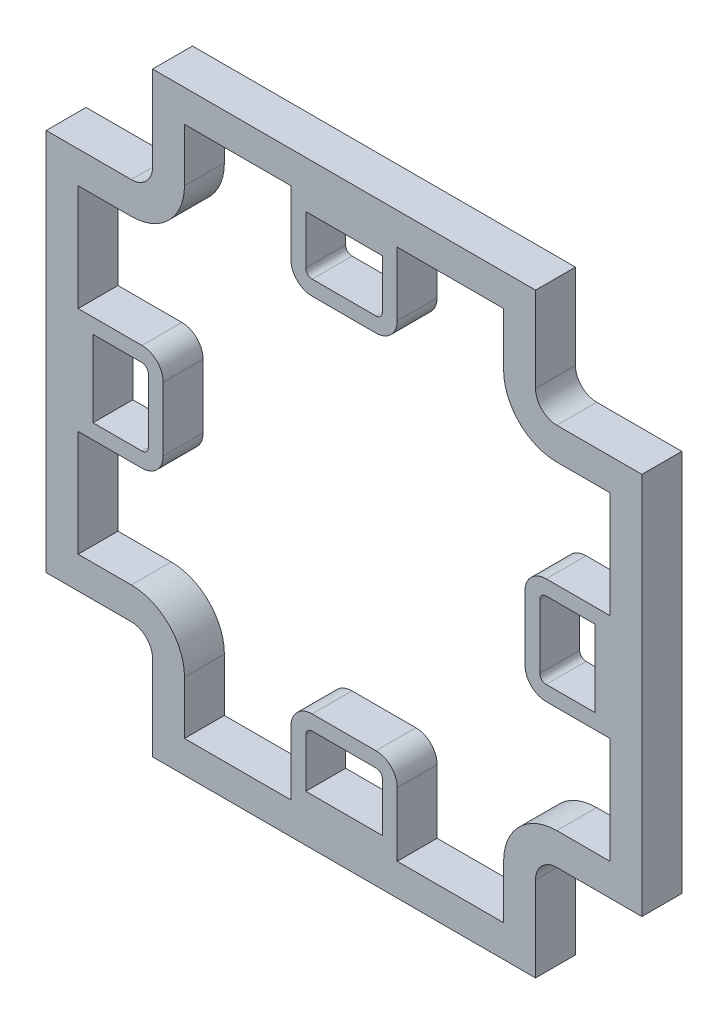
from build123d import *

# Parameters (mm, degrees)
EXTRUDE_THIN1_DEPTH = 3.75
EXTRUDE_THIN2_DEPTH = 3.75
EXTRUDE_THIN3_DEPTH = 3.75


with BuildPart() as part:
    # Sketch1 → Extrude-Thin1 (new body)
    with BuildSketch(Plane.XY):
        with BuildLine():
            Line((73, 62), (73, 54))
            Line((73, 54), (109, 54))
            Line((109, 54), (109, 62))
            ThreePointArc((109, 62), (109.585786438, 63.414213562), (111, 64))
            Line((111, 64), (119, 64))
            Line((119, 64), (119, 100))
            Line((119, 100), (111, 100))
            ThreePointArc((111, 100), (109.585786438, 100.585786438), (109, 102))
            Line((109, 102), (109, 110))
            Line((109, 110), (73, 110))
            Line((73, 110), (73, 102))
            ThreePointArc((73, 102), (72.414213562, 100.585786438), (71, 100))
            Line((71, 100), (63, 100))
            Line((63, 100), (63, 64))
            Line((63, 64), (71, 64))
            ThreePointArc((71, 64), (72.414213562, 63.414213562), (73, 62))
        make_face()
        with BuildLine():
            Line((76, 62), (76, 57))
            Line((76, 57), (106, 57))
            Line((106, 57), (106, 62))
            ThreePointArc((106, 62), (107.464466094, 65.535533906), (111, 67))
            Line((111, 67), (116, 67))
            Line((116, 67), (116, 97))
            Line((116, 97), (111, 97))
            ThreePointArc((111, 97), (107.464466094, 98.464466094), (106, 102))
            Line((106, 102), (106, 107))
            Line((106, 107), (76, 107))
            Line((76, 107), (76, 102))
            ThreePointArc((76, 102), (74.535533906, 98.464466094), (71, 97))
            Line((71, 97), (66, 97))
            Line((66, 97), (66, 67))
            Line((66, 67), (71, 67))
            ThreePointArc((71, 67), (74.535533906, 65.535533906), (76, 62))
        make_face(mode=Mode.SUBTRACT)
    extrude(amount=EXTRUDE_THIN1_DEPTH)

    # Sketch2 → Extrude-Thin2 (add)
    # profile 1 of 2: a face of its own
    with BuildSketch(Plane.XY):
        with BuildLine():
            Line((74, 85), (74, 79))
            ThreePointArc((74, 79), (73.414213562, 77.585786438), (72, 77))
            Line((72, 77), (66, 77))
            Line((66, 77), (66, 87))
            Line((66, 87), (72, 87))
            ThreePointArc((72, 87), (73.414213562, 86.414213562), (74, 85))
        make_face()
        with BuildLine():
            Line((72.6, 85), (72.6, 79))
            ThreePointArc((72.6, 79), (72.424264069, 78.575735931), (72, 78.4))
            Line((72, 78.4), (67.4, 78.4))
            Line((67.4, 78.4), (67.4, 85.6))
            Line((67.4, 85.6), (72, 85.6))
            ThreePointArc((72, 85.6), (72.424264069, 85.424264069), (72.6, 85))
        make_face(mode=Mode.SUBTRACT)
    # profile 2 of 2: a face of its own
    with BuildSketch(Plane.XY):
        with BuildLine():
            Line((108, 79), (108, 85))
            ThreePointArc((108, 85), (108.585786438, 86.414213562), (110, 87))
            Line((110, 87), (116, 87))
            Line((116, 87), (116, 77))
            Line((116, 77), (110, 77))
            ThreePointArc((110, 77), (108.585786438, 77.585786438), (108, 79))
        make_face()
        with BuildLine():
            Line((109.4, 79), (109.4, 85))
            ThreePointArc((109.4, 85), (109.575735931, 85.424264069), (110, 85.6))
            Line((110, 85.6), (114.6, 85.6))
            Line((114.6, 85.6), (114.6, 78.4))
            Line((114.6, 78.4), (110, 78.4))
            ThreePointArc((110, 78.4), (109.575735931, 78.575735931), (109.4, 79))
        make_face(mode=Mode.SUBTRACT)
    extrude(amount=EXTRUDE_THIN2_DEPTH)

    # Sketch3 → Extrude-Thin3 (add)
    # profile 1 of 2: a face of its own
    with BuildSketch(Plane.XY):
        with BuildLine():
            Line((96, 101), (96, 107))
            Line((96, 107), (86, 107))
            Line((86, 107), (86, 101))
            ThreePointArc((86, 101), (86.585786438, 99.585786438), (88, 99))
            Line((88, 99), (94, 99))
            ThreePointArc((94, 99), (95.414213562, 99.585786438), (96, 101))
        make_face()
        with BuildLine():
            Line((94.6, 101), (94.6, 105.6))
            Line((94.6, 105.6), (87.4, 105.6))
            Line((87.4, 105.6), (87.4, 101))
            ThreePointArc((87.4, 101), (87.575735931, 100.575735931), (88, 100.4))
            Line((88, 100.4), (94, 100.4))
            ThreePointArc((94, 100.4), (94.424264069, 100.575735931), (94.6, 101))
        make_face(mode=Mode.SUBTRACT)
    # profile 2 of 2: a face of its own
    with BuildSketch(Plane.XY):
        with BuildLine():
            Line((86, 63), (86, 57))
            Line((86, 57), (96, 57))
            Line((96, 57), (96, 63))
            ThreePointArc((96, 63), (95.414213562, 64.414213562), (94, 65))
            Line((94, 65), (88, 65))
            ThreePointArc((88, 65), (86.585786438, 64.414213562), (86, 63))
        make_face()
        with BuildLine():
            Line((87.4, 63), (87.4, 58.4))
            Line((87.4, 58.4), (94.6, 58.4))
            Line((94.6, 58.4), (94.6, 63))
            ThreePointArc((94.6, 63), (94.424264069, 63.424264069), (94, 63.6))
            Line((94, 63.6), (88, 63.6))
            ThreePointArc((88, 63.6), (87.575735931, 63.424264069), (87.4, 63))
        make_face(mode=Mode.SUBTRACT)
    extrude(amount=EXTRUDE_THIN3_DEPTH)


solid = part.part
